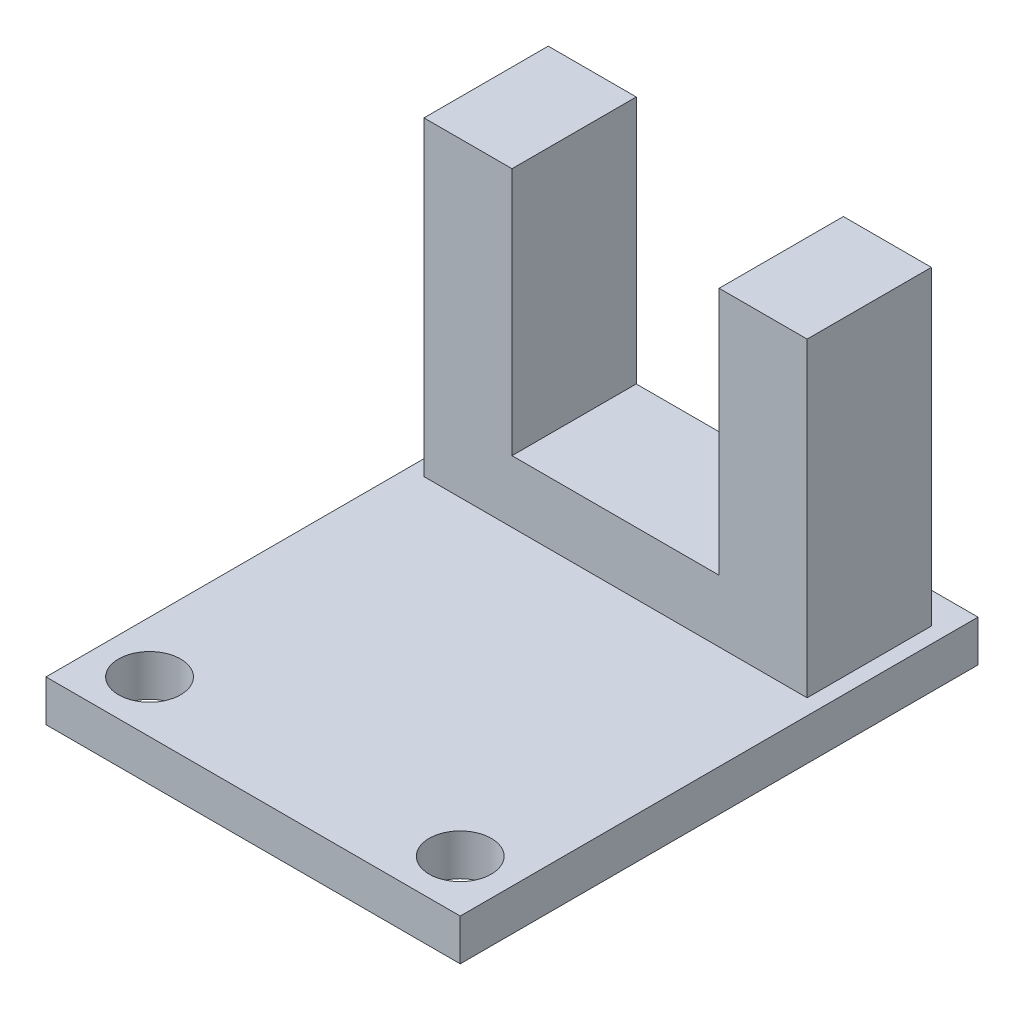
from build123d import *

# Parameters (mm, degrees)
SKETCH_1_W            = 20
SKETCH_1_H            = 25
EXTRUDE_1_DEPTH       = 2
SKETCH_2_W            = 18.5
SKETCH_2_H            = 6
EXTRUDE_2_DEPTH       = 15
SKETCH_3_W            = 10
SKETCH_3_H            = 12
CUT_EXTRUDE_1_DEPTH   = 30.618406439
HOLE_WIZARD_3_0_3_1_D = 3


with BuildPart() as part:
    # 草圖1 → 填料-伸長1 (new body)
    with BuildSketch(Plane.XZ.offset(2)):
        with Locations((0, 11)):
            Rectangle(SKETCH_1_W, SKETCH_1_H)
    extrude(amount=-EXTRUDE_1_DEPTH)

    # 草圖2 → 填料-伸長2 (add)
    with BuildSketch(Plane(origin=(0, 0, 0), x_dir=(-1, 0, 0), z_dir=(0, 1, 0))):
        with Locations((0, 3)):
            Rectangle(SKETCH_2_W, SKETCH_2_H)
    extrude(amount=EXTRUDE_2_DEPTH)

    # 草圖3 → 除料-伸長1 (cut, through all)
    with BuildSketch(Plane(origin=(0, 0, 0), x_dir=(-1, 0, 0), z_dir=(0, 0, -1))):
        with Locations((0, 9)):
            Rectangle(SKETCH_3_W, SKETCH_3_H)
    extrude(amount=-CUT_EXTRUDE_1_DEPTH, mode=Mode.SUBTRACT)

    # Ø3.0 (3) 直徑孔1 (through all)
    with Locations(Plane(origin=(0, 0, 0), x_dir=(1, 0, 0), z_dir=(0, 1, 0))):
        with Locations((-7.5, -21), (7.5, -21)):
            Hole(HOLE_WIZARD_3_0_3_1_D / 2)


solid = part.part
